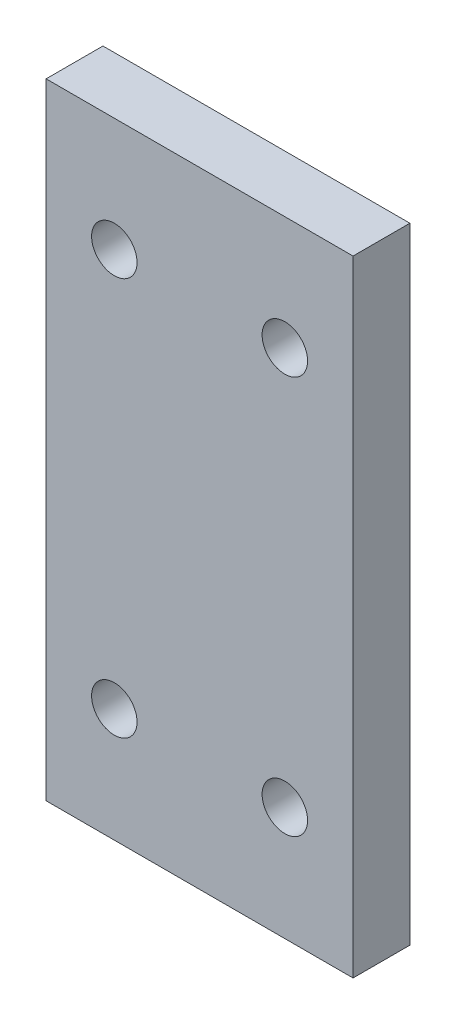
from build123d import *

# Parameters (mm, degrees)
SKETCH1_W           = 27
SKETCH1_H           = 55
SKETCH1_R           = 2
BOSS_EXTRUDE1_DEPTH = 5


with BuildPart() as part:
    # Sketch1 → Boss-Extrude1 (new body)
    with BuildSketch(Plane.XY):
        with Locations((-13.5, 27.5)):
            Rectangle(SKETCH1_W, SKETCH1_H)
        with Locations((-21, 45)):
            Circle(SKETCH1_R, mode=Mode.SUBTRACT)
        with Locations((-21, 10)):
            Circle(SKETCH1_R, mode=Mode.SUBTRACT)
        with Locations(Location((-6, 10, 0), (0, 0, 180))):
            Circle(SKETCH1_R, mode=Mode.SUBTRACT)
        with Locations(Location((-6, 45, 0), (0, 0, 180))):
            Circle(SKETCH1_R, mode=Mode.SUBTRACT)
    extrude(amount=BOSS_EXTRUDE1_DEPTH)


solid = part.part
